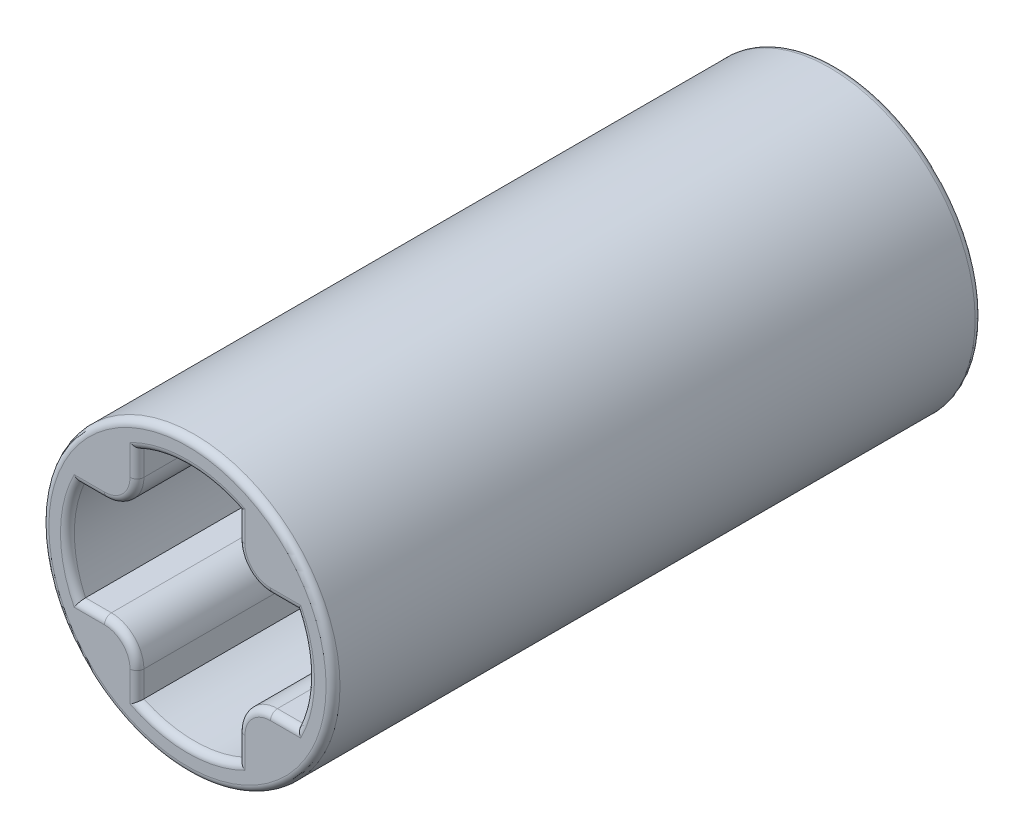
from build123d import *

# Parameters (mm, degrees)
SKETCH1_R           = 3.14
SKETCH1_R_2         = 1.1
BOSS_EXTRUDE1_DEPTH = 6
SKETCH2_R           = 3.14
BOSS_EXTRUDE3_DEPTH = 8
FILLET2_R           = 0.7
FILLET3_R           = 0.15
FILLET4_R           = 0.15


with BuildPart() as part:
    # Sketch1 → Boss-Extrude1 (new body)
    with BuildSketch(Plane.XY):
        Circle(SKETCH1_R)
        Circle(SKETCH1_R_2, mode=Mode.SUBTRACT)
    extrude(amount=BOSS_EXTRUDE1_DEPTH)

    # Sketch2 → Boss-Extrude3 (add)
    with BuildSketch(Plane.XY.offset(6)):
        Circle(SKETCH2_R)
        with BuildLine():
            Line((1.09, 1.09), (2.349468025, 1.09))
            ThreePointArc((2.349468025, 1.09), (2.59, 0), (2.349468025, -1.09))
            Line((2.349468025, -1.09), (1.09, -1.09))
            Line((1.09, -1.09), (1.09, -2.349468025))
            ThreePointArc((1.09, -2.349468025), (0, -2.59), (-1.09, -2.349468025))
            Line((-1.09, -2.349468025), (-1.09, -1.09))
            Line((-1.09, -1.09), (-2.349468025, -1.09))
            ThreePointArc((-2.349468025, -1.09), (-2.59, 0), (-2.349468025, 1.09))
            Line((-2.349468025, 1.09), (-1.09, 1.09))
            Line((-1.09, 1.09), (-1.09, 2.349468025))
            ThreePointArc((-1.09, 2.349468025), (0, 2.59), (1.09, 2.349468025))
            Line((1.09, 2.349468025), (1.09, 1.09))
        make_face(mode=Mode.SUBTRACT)
    extrude(amount=BOSS_EXTRUDE3_DEPTH)

    # Fillet2
    fillet2_edges = [part.edges().sort_by_distance(p)[0] for p in [
        (-1.09, -1.09, 10),
        (-1.09, 1.09, 10),
        (1.09, 1.09, 10),
        (1.09, -1.09, 10),
    ]]
    fillet(fillet2_edges, radius=FILLET2_R)

    # Fillet3
    fillet3_edges = [part.edges().sort_by_distance(p)[0] for p in [
        (-3.14, 0, 0),
        (-1.1, 0, 0),
    ]]
    fillet(fillet3_edges, radius=FILLET3_R)

    # Fillet4
    fillet4_edges = [part.edges().sort_by_distance(p)[0] for p in [
        (0, -2.59, 14),
        (-2.59, 0, 14),
        (2.59, 0, 14),
        (-1.09, -2.069734012, 14),
        (-2.069734012, 1.09, 14),
        (0, 2.59, 14),
        (2.069734012, -1.09, 14),
        (-3.14, 0, 14),
        (-1.09, 2.069734012, 14),
        (-2.069734012, -1.09, 14),
        (1.09, 2.069734012, 14),
        (2.069734012, 1.09, 14),
        (1.09, -2.069734012, 14),
        (-1.295025253, -1.295025253, 14),
        (1.295025253, -1.295025253, 14),
        (1.295025253, 1.295025253, 14),
        (-1.295025253, 1.295025253, 14),
    ]]
    fillet(fillet4_edges, radius=FILLET4_R)


solid = part.part
